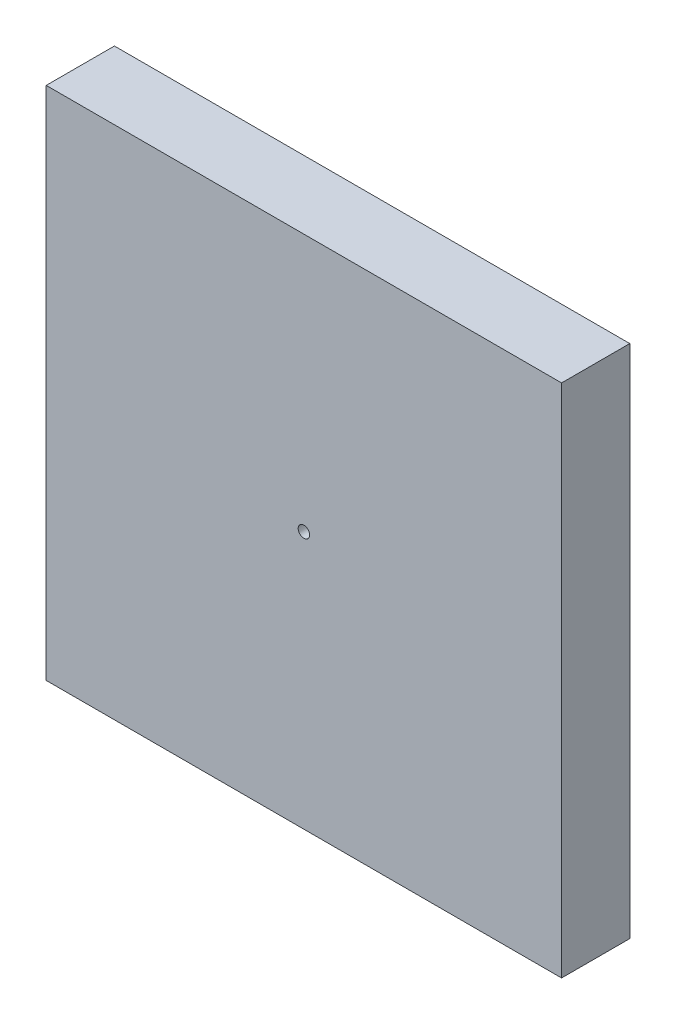
from build123d import *

# Parameters (mm, degrees)
SKETCH1_W           = 90
SKETCH1_H           = 90
SKETCH1_R           = 1
BOSS_EXTRUDE1_DEPTH = 11.91


with BuildPart() as part:
    # Sketch1 → Boss-Extrude1 (new body)
    with BuildSketch(Plane.XY):
        with Locations((90, 5)):
            Rectangle(SKETCH1_W, SKETCH1_H)
        with Locations((90, 5)):
            Circle(SKETCH1_R, mode=Mode.SUBTRACT)
    extrude(amount=BOSS_EXTRUDE1_DEPTH)


solid = part.part
